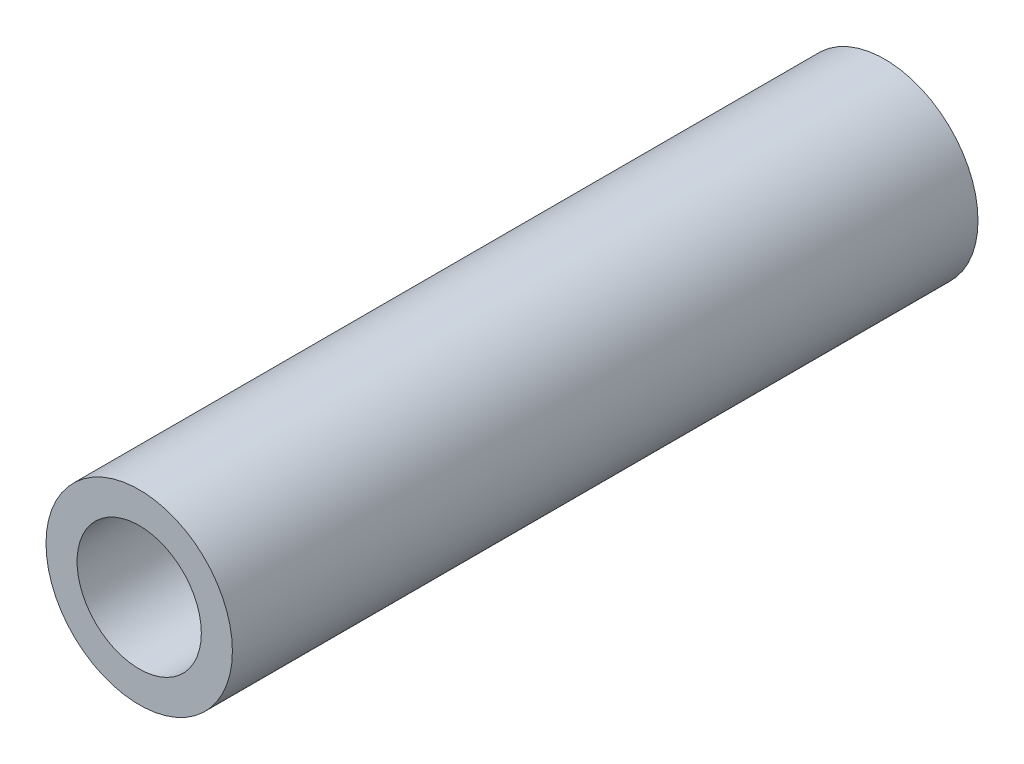
from build123d import *

# Parameters (mm, degrees)
ESQUISSE1_R        = 3
ESQUISSE1_R_2      = 2
BOSS_EXTRU_1_DEPTH = 24


with BuildPart() as part:
    # Esquisse1 → Boss.-Extru.1 (new body)
    with BuildSketch(Plane.XY):
        Circle(ESQUISSE1_R)
        Circle(ESQUISSE1_R_2, mode=Mode.SUBTRACT)
    extrude(amount=BOSS_EXTRU_1_DEPTH)


solid = part.part
